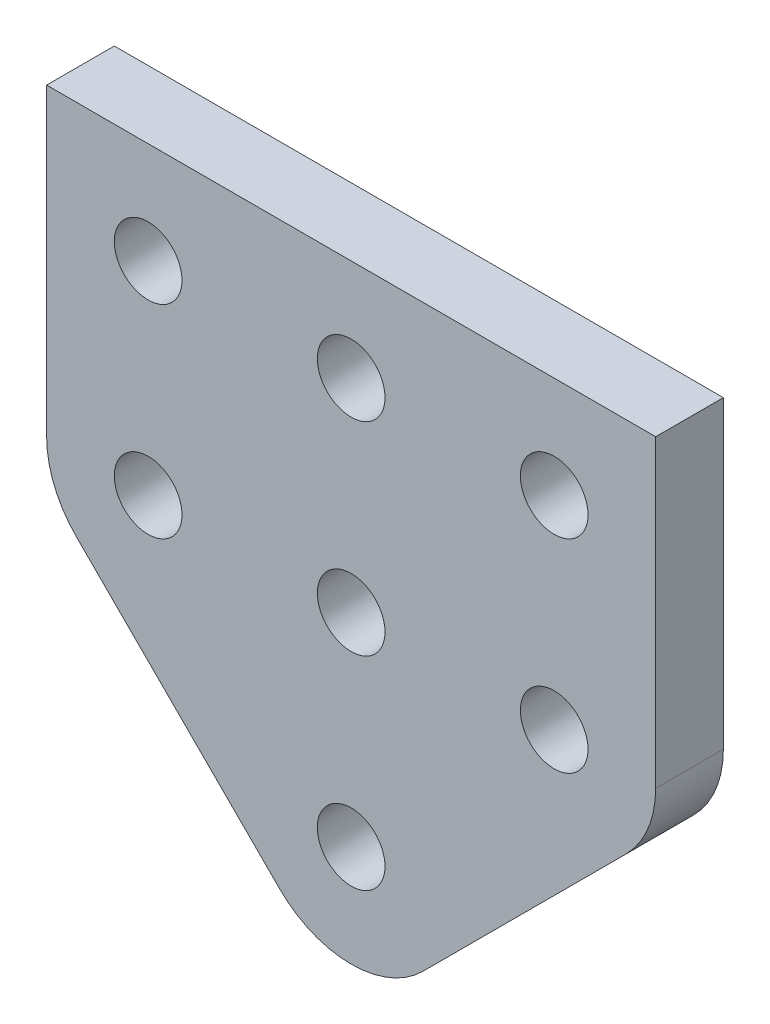
from build123d import *

# Parameters (mm, degrees)
MODEL_R                 = 1.5
SALIENTE_EXTRUIR1_DEPTH = 3


with BuildPart() as part:
    # Model → Saliente-Extruir1 (new body)
    with BuildSketch(Plane.XY):
        with BuildLine():
            Line((174.227054575, 213.178720063), (174.227054575, 204.178720063))
            ThreePointArc((174.227054575, 204.178720063), (174.569596678, 202.456644617), (175.545074059, 200.996739548))
            Line((175.545074059, 200.996739548), (184.545074059, 191.996739548))
            ThreePointArc((184.545074059, 191.996739548), (187.727054575, 190.678720063), (190.90903509, 191.996739548))
            Line((190.90903509, 191.996739548), (199.90903509, 200.996739548))
            ThreePointArc((199.90903509, 200.996739548), (200.884512471, 202.456644617), (201.227054575, 204.178720063))
            Line((201.227054575, 204.178720063), (201.227054575, 217.678720063))
            Line((201.227054575, 217.678720063), (174.227054575, 217.678720063))
            Line((174.227054575, 217.678720063), (174.227054575, 213.178720063))
        make_face()
        with Locations((187.727054575, 204.178720063)):
            Circle(MODEL_R, mode=Mode.SUBTRACT)
        with Locations((178.727054575, 204.178720063)):
            Circle(MODEL_R, mode=Mode.SUBTRACT)
        with Locations((187.727054575, 213.178720063)):
            Circle(MODEL_R, mode=Mode.SUBTRACT)
        with Locations((178.727054575, 213.178720063)):
            Circle(MODEL_R, mode=Mode.SUBTRACT)
        with Locations((196.727054575, 213.178720063)):
            Circle(MODEL_R, mode=Mode.SUBTRACT)
        with Locations((187.727054575, 195.178720063)):
            Circle(MODEL_R, mode=Mode.SUBTRACT)
        with Locations((196.727054575, 204.178720063)):
            Circle(MODEL_R, mode=Mode.SUBTRACT)
    extrude(amount=SALIENTE_EXTRUIR1_DEPTH)


solid = part.part
